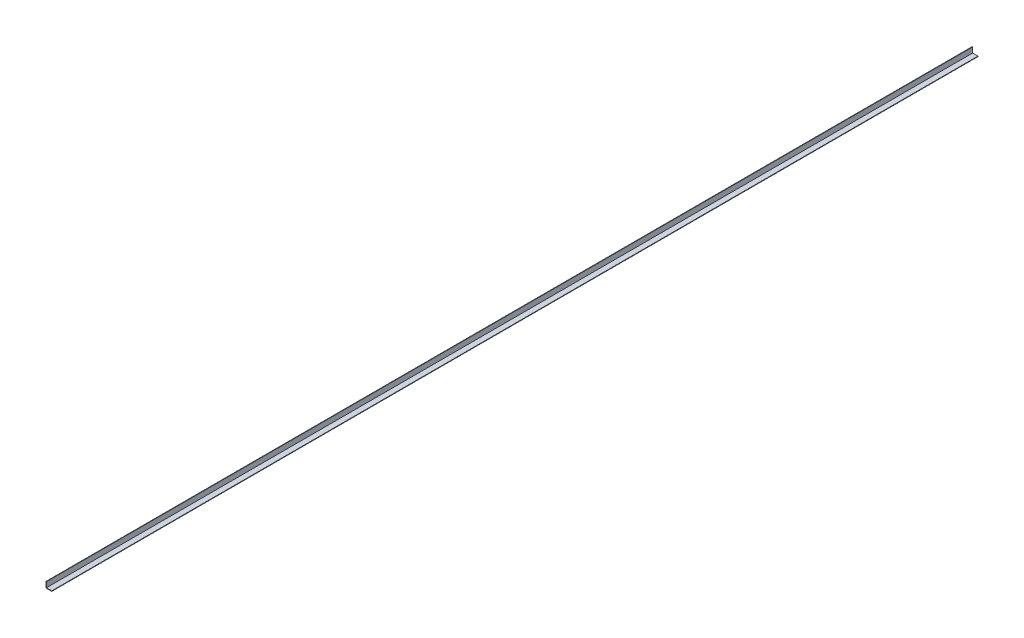
from build123d import *

# Parameters (mm, degrees)
SALIENTE_EXTRUIR1_DEPTH = 6100


with BuildPart() as part:
    # Croquis1 → Saliente-Extruir1 (new body)
    with BuildSketch(Plane.XY):
        Polygon((0, 38.1), (0, 0), (38.1, 0), (38.1, 3.18), (3.18, 3.18), (3.18, 38.1), align=None)
    extrude(amount=-SALIENTE_EXTRUIR1_DEPTH)


solid = part.part
